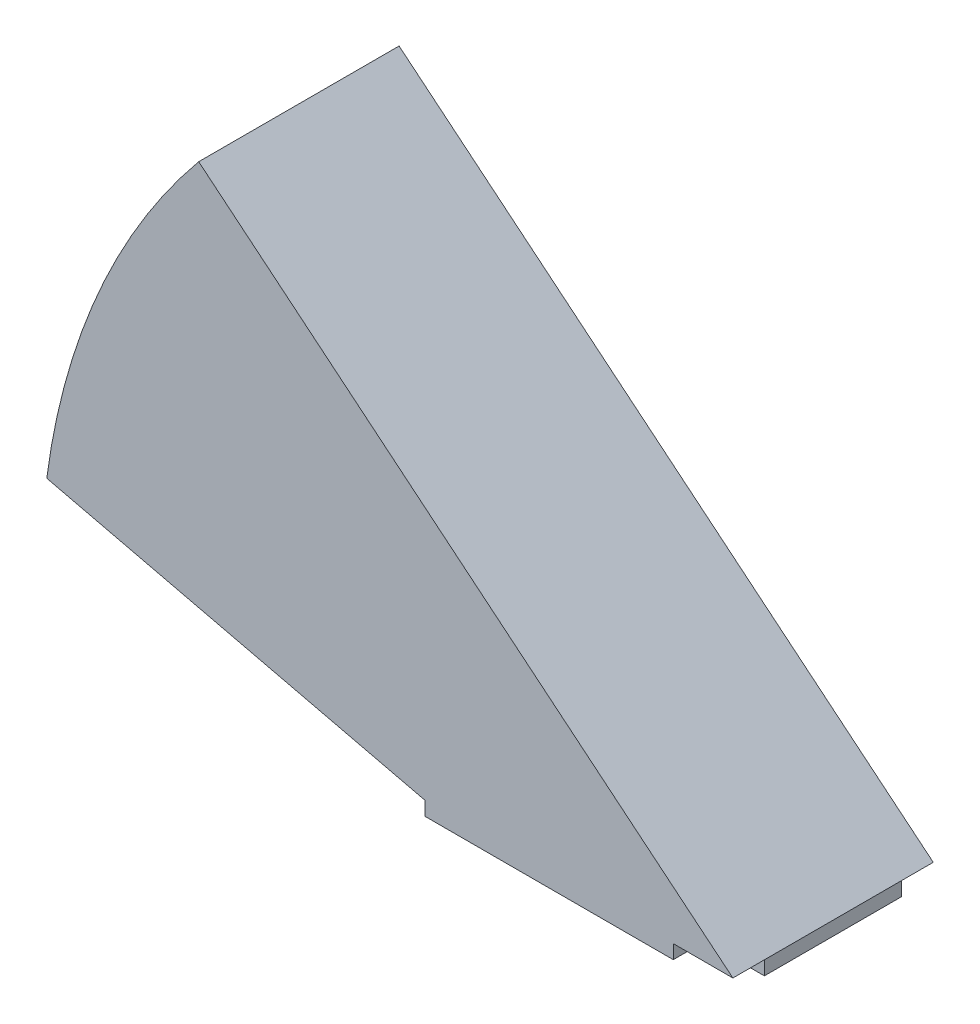
from build123d import *

# Parameters (mm, degrees)
SKETCH1_R           = 4.566693037
SKETCH1_W           = 17.1
SKETCH1_H           = 39.4
BOSS_EXTRUDE1_DEPTH = 4
BOSS_EXTRUDE2_REACH = 107.531


with BuildPart() as part:
    # Sketch1 → Boss-Extrude1 (new body)
    # profile 1 of 2: a face of its own
    with BuildSketch(Plane(origin=(0, 0, 0), x_dir=(1, 0, 0), z_dir=(0, 1, 0))):
        Polygon((0, 57.5), (0, 0), (71.3, 0), (71.3, 9.05), (71.3, 48.45), (71.3, 57.5), align=None)
        with Locations(Location((31.977132175, 7.725129874, 0), (0, 0, 270))):
            Circle(SKETCH1_R, mode=Mode.SUBTRACT)
        with Locations(Location((31.977132175, 49.774870126, 0), (0, 0, 270))):
            Circle(SKETCH1_R, mode=Mode.SUBTRACT)
    # profile 2 of 2: a face of its own
    with BuildSketch(Plane(origin=(0, 0, 0), x_dir=(1, 0, 0), z_dir=(0, 1, 0))):
        with Locations((79.85, 28.75)):
            Rectangle(SKETCH1_W, SKETCH1_H)
    extrude(amount=BOSS_EXTRUDE1_DEPTH)

    # Boss-Extrude2: up to this face of the body (flat: up to its plane)
    boss_extrude2_end = Plane(part.part.faces().sort_by_distance((35.65, 2, -57.5))[0])
    # Sketch2 → Boss-Extrude2 (add, up to the picked face)
    with BuildSketch(Plane.XY, mode=Mode.PRIVATE) as boss_extrude2_sk1:
        with BuildLine():
            Line((0, 4), (88.4, 4))
            Line((88.4, 4), (-64.878686432, 130.222546803))
            ThreePointArc((-64.878686432, 130.222546803), (-93.746808792, 83.050787997), (-108.484737296, 29.746596971))
            Line((-108.484737296, 29.746596971), (0, 4))
        make_face()
    boss_extrude2_tool1 = split(extrude(boss_extrude2_sk1.sketch, amount=-BOSS_EXTRUDE2_REACH, mode=Mode.PRIVATE), bisect_by=boss_extrude2_end, keep=Keep.BOTH, mode=Mode.PRIVATE)
    add(boss_extrude2_tool1.solids().sort_by(Axis((-29.138762, 51.950808, 0), (0, 0, -1)))[0])


solid = part.part
